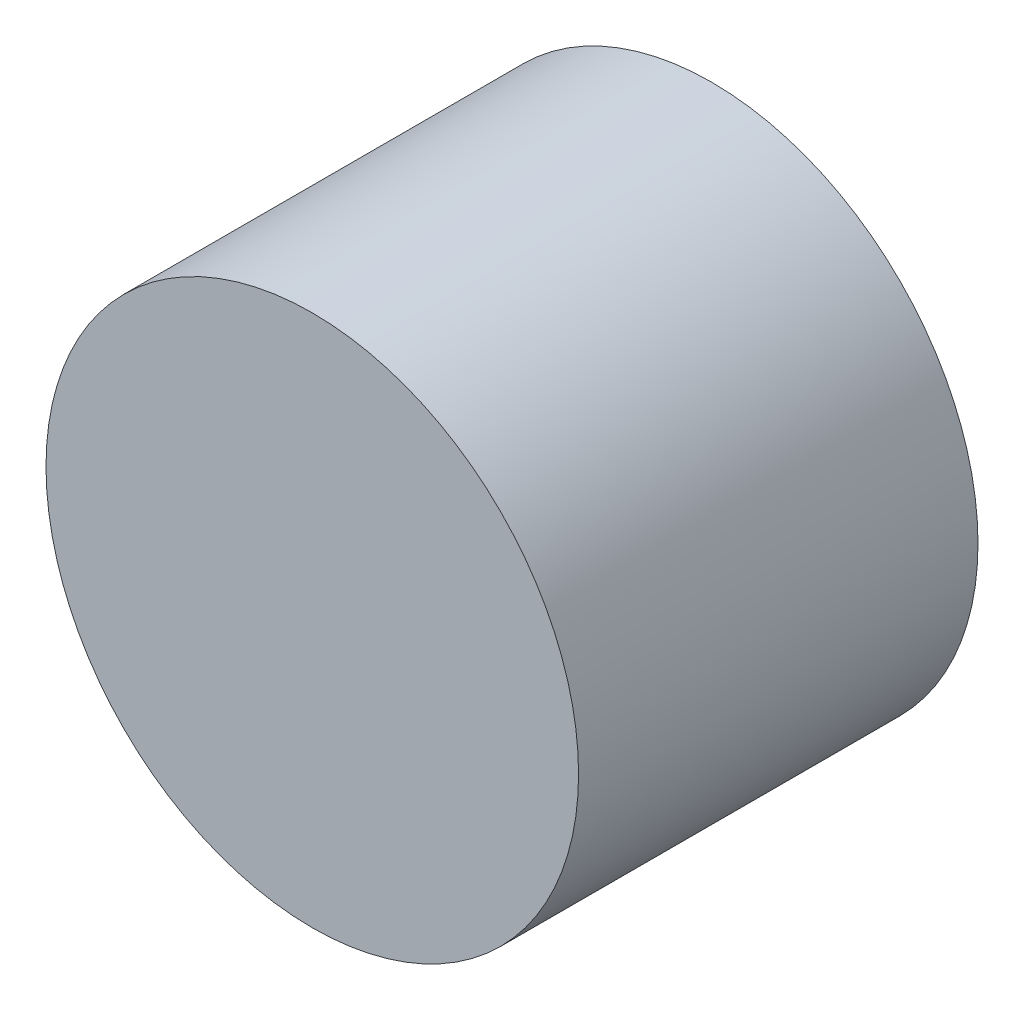
from build123d import *

# Parameters (mm, degrees)
SKETCH_1_R      = 4
EXTRUDE_1_DEPTH = 6


with BuildPart() as part:
    # 草圖1 → 填料-伸長1 (new body)
    with BuildSketch(Plane.XY):
        Circle(SKETCH_1_R)
    extrude(amount=EXTRUDE_1_DEPTH)


solid = part.part
